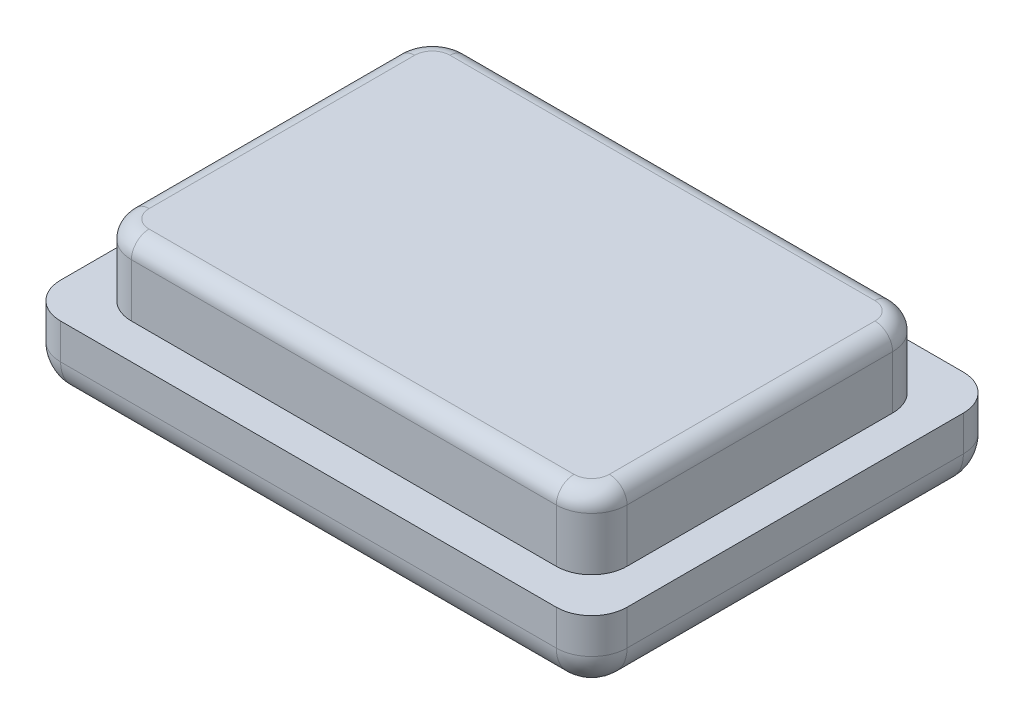
from build123d import *

# Parameters (mm, degrees)
CROQUIS1_W              = 16
CROQUIS1_H              = 11.5
SALIENTE_EXTRUIR2_DEPTH = 2
CROQUIS2_W              = 14
CROQUIS2_H              = 9.5
SALIENTE_EXTRUIR3_DEPTH = 2
REDONDEO1_R             = 1
REDONDEO2_R             = 1
REDONDEO3_R             = 0.5


with BuildPart() as part:
    # Croquis1 → Saliente-Extruir2 (new body)
    with BuildSketch(Plane(origin=(0, 0, 0), x_dir=(1, 0, 0), z_dir=(0, 1, 0))):
        Rectangle(CROQUIS1_W, CROQUIS1_H)
    extrude(amount=SALIENTE_EXTRUIR2_DEPTH)

    # Croquis2 → Saliente-Extruir3 (add)
    with BuildSketch(Plane(origin=(0, 2, 0), x_dir=(1, 0, 0), z_dir=(0, 1, 0))):
        Rectangle(CROQUIS2_W, CROQUIS2_H)
    extrude(amount=SALIENTE_EXTRUIR3_DEPTH)

    # Redondeo1
    redondeo1_edges = [part.edges().sort_by_distance(p)[0] for p in [
        (0, 0, 5.75),
        (8, 0, 0),
        (0, 0, -5.75),
        (-8, 0, 0),
        (-8, 1, 5.75),
        (8, 1, 5.75),
        (8, 1, -5.75),
        (-8, 1, -5.75),
    ]]
    fillet(redondeo1_edges, radius=REDONDEO1_R)

    # Redondeo2
    redondeo2_edges = [part.edges().sort_by_distance(p)[0] for p in [
        (7, 3, 4.75),
        (7, 3, -4.75),
        (-7, 3, -4.75),
        (-7, 3, 4.75),
    ]]
    fillet(redondeo2_edges, radius=REDONDEO2_R)

    # Redondeo3
    redondeo3_edges = [part.edges().sort_by_distance(p)[0] for p in [
        (7, 4, 0),
        (0, 4, 4.75),
        (0, 4, -4.75),
        (-7, 4, 0),
        (-6.707106781, 4, 4.457106781),
        (-6.707106781, 4, -4.457106781),
        (6.707106781, 4, -4.457106781),
        (6.707106781, 4, 4.457106781),
    ]]
    fillet(redondeo3_edges, radius=REDONDEO3_R)


solid = part.part
